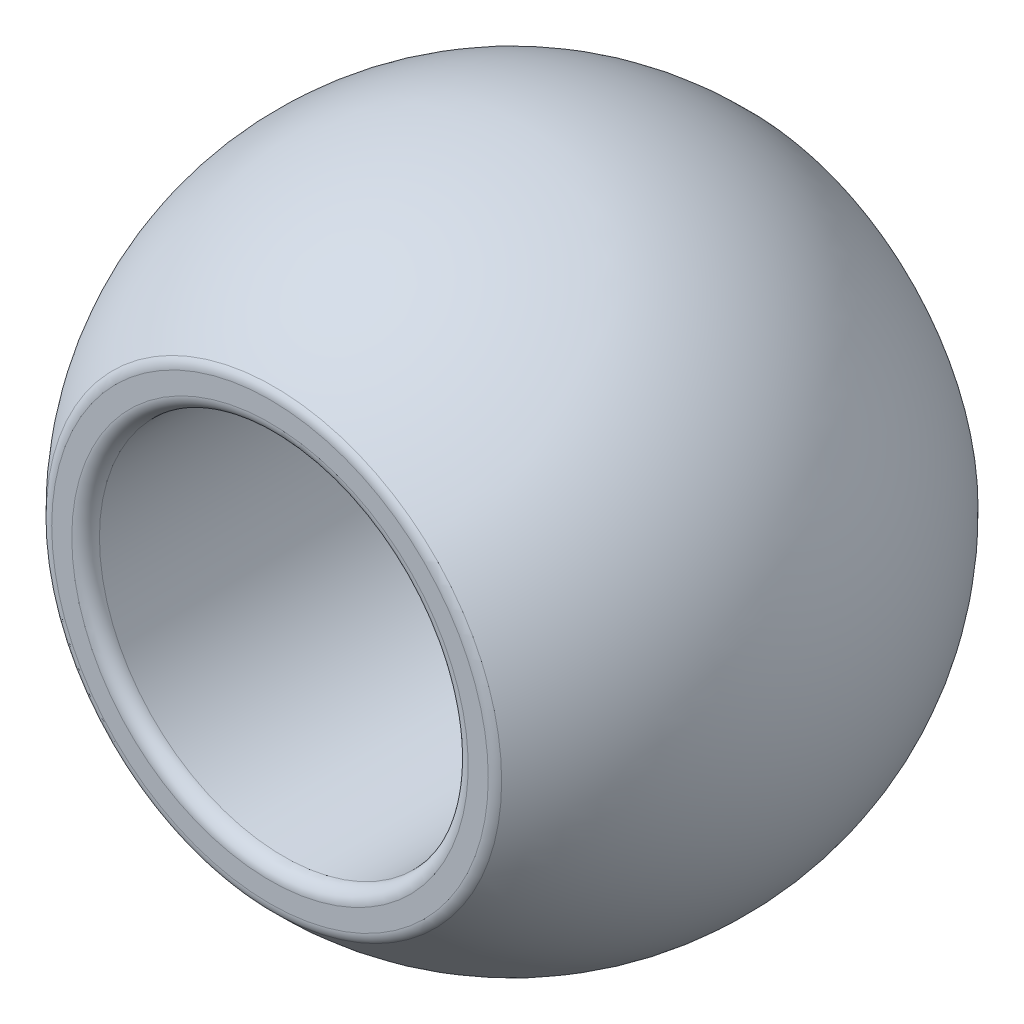
from build123d import *

# Parameters (mm, degrees)
CORTE_EXTRUS_O1_DEPTH      = 25.768326548
CORTE_EXTRUS_O1_DEPTH_BACK = 25.768326548
ESBO_O2_W                  = 15
ESBO_O2_H                  = 30
ESBO_O3_R                  = 8
CORTE_EXTRUS_O2_DEPTH      = 33.000312498
FILETE1_R                  = 0.6
SCALE1_SCALE               = 0.5


with BuildPart() as part:
    # Esboço1 → Revolução1 (revolve)
    with BuildSketch(Plane.XY):
        with BuildLine():
            Line((0, -14.3), (0, 14.3))
            ThreePointArc((0, 14.3), (14.3, 0), (0, -14.3))
        make_face()
    revolve(axis=Axis((0, -14.3, 0), (0, 1, 0)))

    # Esboço2 → Corte-extrusão1 (cut, two sides: drawn at the far end of the back side and taken through both)
    with BuildSketch(Plane(origin=(0, 0, 0), x_dir=(0, 0, -1), z_dir=(1, 0, 0)).offset(-CORTE_EXTRUS_O1_DEPTH_BACK)):
        with Locations((-18, 0)):
            Rectangle(ESBO_O2_W, ESBO_O2_H)
        with Locations((18, 0)):
            Rectangle(ESBO_O2_W, ESBO_O2_H)
    extrude(amount=CORTE_EXTRUS_O1_DEPTH + CORTE_EXTRUS_O1_DEPTH_BACK, mode=Mode.SUBTRACT)

    # Esboço3 → Corte-extrusão2 (cut, through all)
    with BuildSketch(Plane.XY.offset(10.5)):
        Circle(ESBO_O3_R)
    extrude(amount=-CORTE_EXTRUS_O2_DEPTH, mode=Mode.SUBTRACT)

    # Filete1
    filete1_edges = [part.edges().sort_by_distance(p)[0] for p in [
        (0, 9.70772888, -10.5),
        (-8, 0, -10.5),
        (-8, 0, 10.5),
        (0, 9.70772888, 10.5),
    ]]
    fillet(filete1_edges, radius=FILETE1_R)


with BuildPart() as part_1:
    # Scale1: scaled about (-1.207e-06, 2.588e-06, 0)
    add(part.part.scale(SCALE1_SCALE).moved(Location((-6.04e-07, 1.294e-06, 0))))


solid = part_1.part
